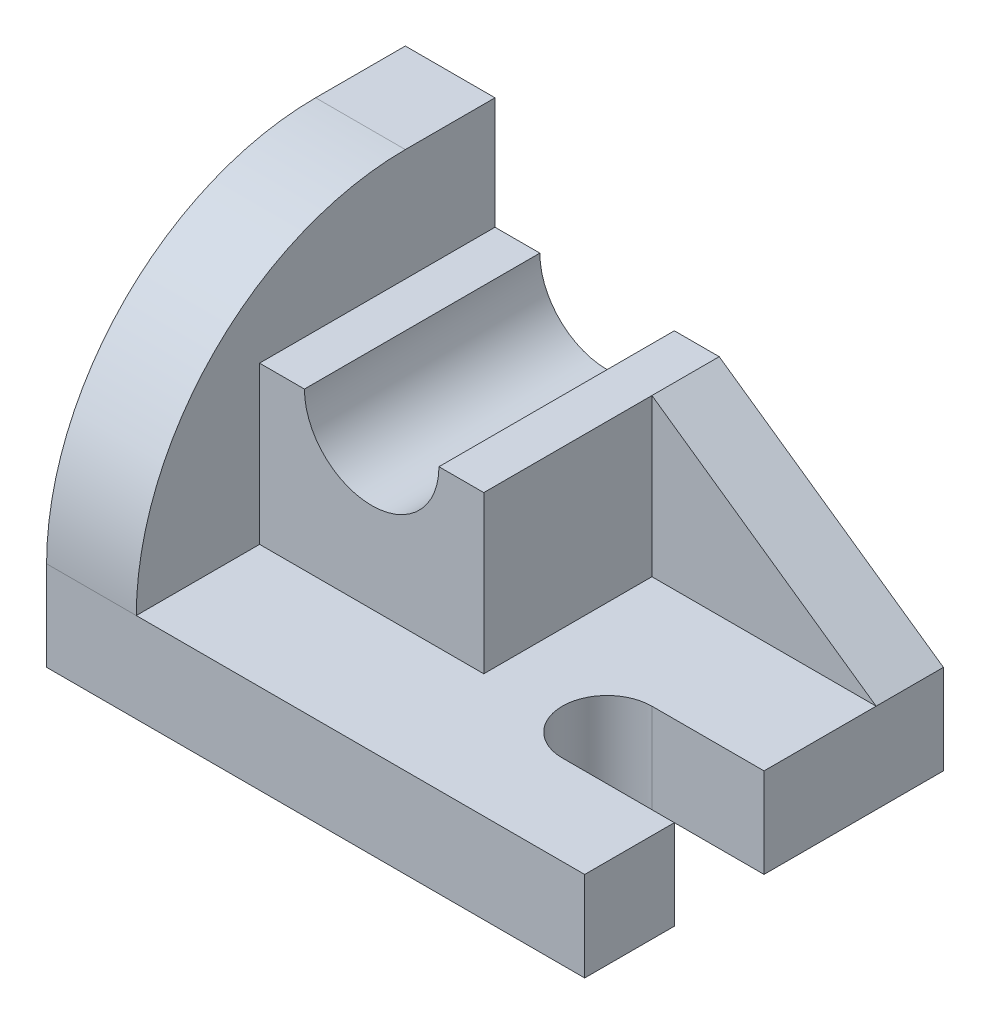
from build123d import *

# Parameters (mm, degrees)
SKETCH1_W           = 96
SKETCH1_H           = 64
BOSS_EXTRUDE1_DEPTH = 16
CUT_EXTRUDE1_DEPTH  = 16
BOSS_EXTRUDE2_DEPTH = 16
SKETCH4_W           = 40
SKETCH4_H           = 42
BOSS_EXTRUDE3_DEPTH = 28
CUT_EXTRUDE2_REACH  = 124.784
SKETCH5_R           = 12
BOSS_EXTRUDE4_DEPTH = 12


with BuildPart() as part:
    # Sketch1 → Boss-Extrude1 (new body)
    with BuildSketch(Plane(origin=(0, 0, 0), x_dir=(1, 0, 0), z_dir=(0, 1, 0))):
        with Locations((48, 32)):
            Rectangle(SKETCH1_W, SKETCH1_H)
    extrude(amount=BOSS_EXTRUDE1_DEPTH)

    # Sketch2 → Cut-Extrude1 (cut)
    with BuildSketch(Plane(origin=(0, 16, 0), x_dir=(1, 0, 0), z_dir=(0, 1, 0))):
        with BuildLine():
            Line((96, 16), (76, 16))
            ThreePointArc((76, 16), (68, 24), (76, 32))
            Line((76, 32), (96, 32))
            ThreePointArc((96, 32), (104, 24), (96, 16))
        make_face()
    extrude(amount=-CUT_EXTRUDE1_DEPTH, mode=Mode.SUBTRACT)

    # Sketch3 → Boss-Extrude2 (add)
    with BuildSketch(Plane.ZY):
        with BuildLine():
            Line((-64, 0), (0, 0))
            Line((0, 0), (0, 16))
            ThreePointArc((0, 16), (-14.058874503, 49.941125497), (-48, 64))
            Line((-48, 64), (-64, 64))
            Line((-64, 64), (-64, 0))
        make_face()
    extrude(amount=-BOSS_EXTRUDE2_DEPTH)

    # Sketch4 → Boss-Extrude3 (add)
    with BuildSketch(Plane(origin=(0, 16, 0), x_dir=(1, 0, 0), z_dir=(0, 1, 0))):
        with Locations((36, 43)):
            Rectangle(SKETCH4_W, SKETCH4_H)
    extrude(amount=BOSS_EXTRUDE3_DEPTH)

    # Sketch5 → Cut-Extrude2 (cut, up to next)
    with BuildSketch(Plane.XY.offset(-22), mode=Mode.PRIVATE) as cut_extrude2_sk1:
        with Locations((36, 44)):
            Circle(SKETCH5_R)
    cut_extrude2_tool1 = extrude(cut_extrude2_sk1.sketch, amount=-CUT_EXTRUDE2_REACH, mode=Mode.PRIVATE) & part.part
    add(cut_extrude2_tool1.solids().sort_by_distance((36, 44, -22))[0], mode=Mode.SUBTRACT)

    # Sketch7 → Boss-Extrude4 (add)
    with BuildSketch(Plane(origin=(0, 0, -64), x_dir=(-1, 0, 0), z_dir=(0, 0, -1))):
        Polygon((-56, 44), (-96, 16), (-56, 16), align=None)
    extrude(amount=-BOSS_EXTRUDE4_DEPTH)


solid = part.part
